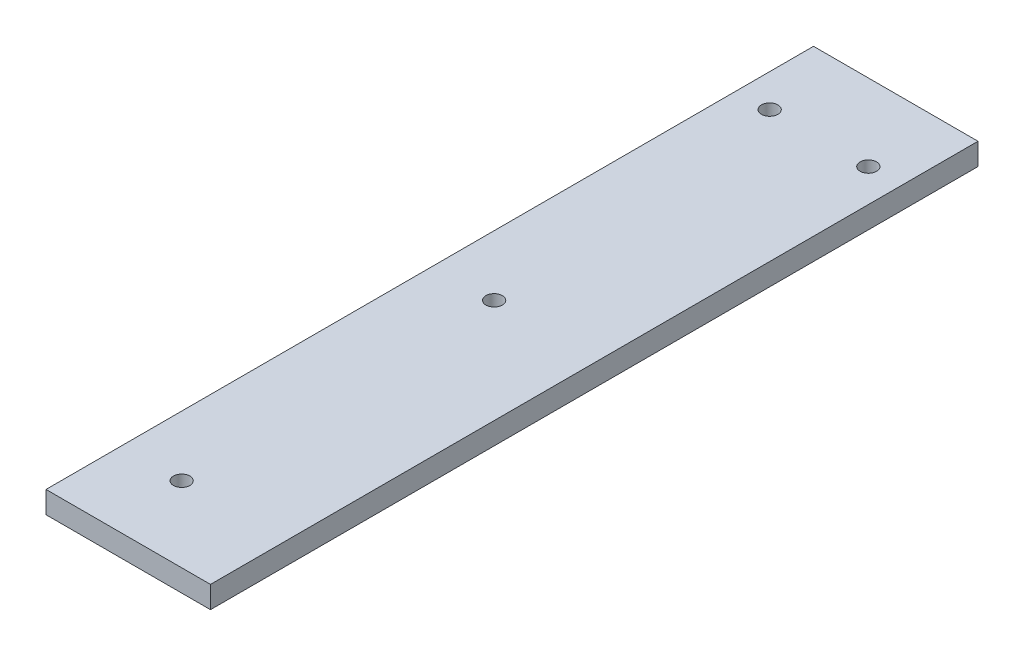
from build123d import *

# Parameters (mm, degrees)
SKETCH1_W           = 15
SKETCH1_H           = 2
BOSS_EXTRUDE1_DEPTH = 70
SKETCH2_R           = 0.75
CUT_EXTRUDE1_DEPTH  = 72.617037079


with BuildPart() as part:
    # Sketch1 → Boss-Extrude1 (new body)
    with BuildSketch(Plane.XY):
        with Locations((7.5, 1)):
            Rectangle(SKETCH1_W, SKETCH1_H)
    extrude(amount=BOSS_EXTRUDE1_DEPTH)

    # Sketch2 → Cut-Extrude1 (cut, through all)
    with BuildSketch(Plane(origin=(0, 2, 0), x_dir=(1, 0, 0), z_dir=(0, 1, 0))):
        with Locations(Location((12, -7, 0), (0, 0, 180))):
            Circle(SKETCH2_R)
        with Locations(Location((3, -7, 0), (0, 0, 180))):
            Circle(SKETCH2_R)
        with Locations(Location((5.5, -34.628634047, 0), (0, 0, 180))):
            Circle(SKETCH2_R)
        with Locations(Location((5.5, -63.128634047, 0), (0, 0, 180))):
            Circle(SKETCH2_R)
    extrude(amount=-CUT_EXTRUDE1_DEPTH, mode=Mode.SUBTRACT)


solid = part.part
